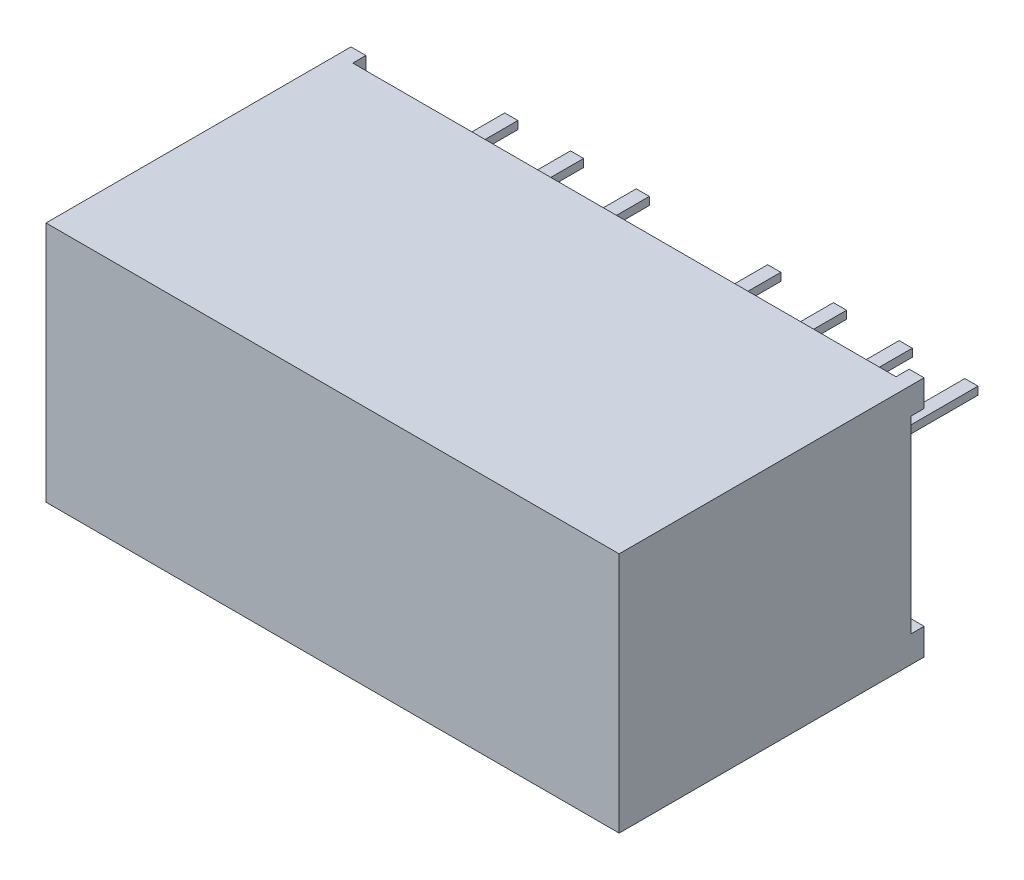
from build123d import *

# Parameters (mm, degrees)
SKETCH2_W               = 21.8
SKETCH2_H               = 11.1
BOSS_EXTRUDE1_DEPTH     = 9.2
SKETCH3_W               = 0.5
SKETCH3_H               = 0.3
BOSS_EXTRUDE2_DEPTH     = 4.6
LPATTERN1_COUNT         = 8
LPATTERN1_PITCH         = 2.5
SKETCH4_W               = 0.567348628
SKETCH4_H               = 1.013461815
BOSS_EXTRUDE3_DEPTH     = 0.5
MIRROR2_COPY_1_SKETCH_W = 0.567348628
MIRROR2_COPY_1_SKETCH_H = 1.013461815
MIRROR2_COPY_1_DEPTH    = 0.5
MIRROR2_COPY_2_SKETCH_W = 0.567348628
MIRROR2_COPY_2_SKETCH_H = 1.013461815
MIRROR2_COPY_2_DEPTH    = 0.5
SKETCH5_R               = 0.530035482
CUT_EXTRUDE1_DEPTH      = 0.2


with BuildPart() as part:
    # Sketch2 → Boss-Extrude1 (new body)
    with BuildSketch(Plane(origin=(0, 0, 0), x_dir=(1, 0, 0), z_dir=(0, 1, 0))):
        with Locations((10.9, 5.55)):
            Rectangle(SKETCH2_W, SKETCH2_H)
    extrude(amount=BOSS_EXTRUDE1_DEPTH)

    # Sketch4 → Boss-Extrude3 (add)
    with BuildSketch(Plane(origin=(0, 0, -11.1), x_dir=(-1, 0, 0), z_dir=(0, 0, -1))):
        with Locations((-0.283674314, 0.506730908)):
            Rectangle(SKETCH4_W, SKETCH4_H)
    boss_extrude3 = extrude(amount=BOSS_EXTRUDE3_DEPTH)

    # Mirror1: Boss-Extrude3 across plane
    add(boss_extrude3.mirror(Plane(origin=(10.9, 0, 0), x_dir=(0, 0, 1), z_dir=(1, 0, 0))))

    # Mirror2 copy 1 sketch → Mirror2 copy 1 (add)
    with BuildSketch(Plane(origin=(21.8, 9.2, -11.1), x_dir=(1, 0, 0), z_dir=(0, 0, -1))):
        with Locations((-0.283674314, 0.506730908)):
            Rectangle(MIRROR2_COPY_1_SKETCH_W, MIRROR2_COPY_1_SKETCH_H)
    extrude(amount=MIRROR2_COPY_1_DEPTH)

    # Mirror2 copy 2 sketch → Mirror2 copy 2 (add)
    with BuildSketch(Plane(origin=(0, 9.2, -11.1), x_dir=(-1, 0, 0), z_dir=(0, 0, -1))):
        with Locations((-0.283674314, -0.506730908)):
            Rectangle(MIRROR2_COPY_2_SKETCH_W, MIRROR2_COPY_2_SKETCH_H)
    extrude(amount=MIRROR2_COPY_2_DEPTH)

    # Sketch5 → Cut-Extrude1 (cut)
    with BuildSketch(Plane.XZ):
        with Locations((1.995392022, -9.887361719)):
            Circle(SKETCH5_R)
    extrude(amount=-CUT_EXTRUDE1_DEPTH, mode=Mode.SUBTRACT)


with BuildPart() as body_2:
    # Sketch3 → Boss-Extrude2 (new body)
    with BuildSketch(Plane(origin=(0, 0, -11.1), x_dir=(-1, 0, 0), z_dir=(0, 0, -1))):
        with Locations((-2, 5.7)):
            Rectangle(SKETCH3_W, SKETCH3_H)
    boss_extrude2 = extrude(amount=BOSS_EXTRUDE2_DEPTH)


with BuildPart() as lpattern1_1:
    # LPattern1: Boss-Extrude2 ×8, 1 skipped
    with Locations(*[(i * LPATTERN1_PITCH, 0, 0) for i in range(1, LPATTERN1_COUNT) if i not in (3,)]):
        add(boss_extrude2)


solid = Compound([part.part, body_2.part, lpattern1_1.part])
